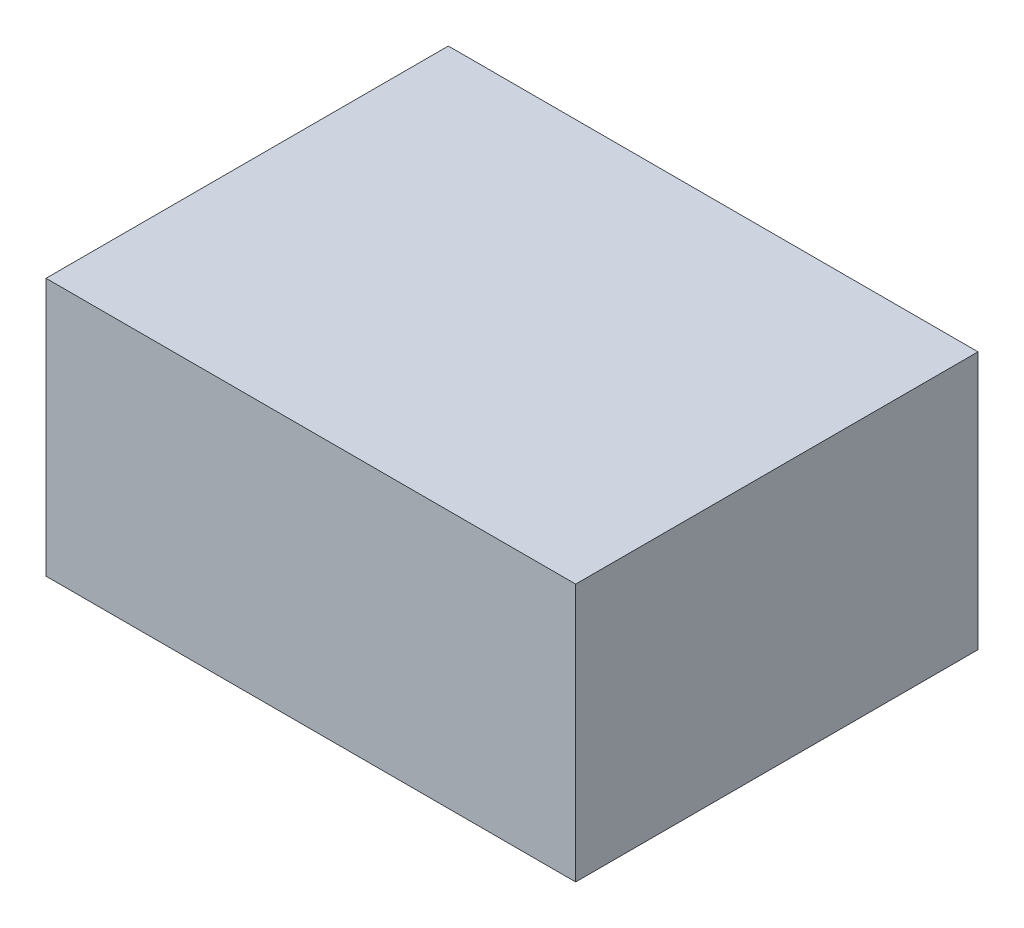
from build123d import *

# Parameters (mm, degrees)
ESQUISSE1_W        = 42.13
ESQUISSE1_H        = 32
BOSS_EXTRU_1_DEPTH = 20.52


with BuildPart() as part:
    # Esquisse1 → Boss.-Extru.1 (new body)
    with BuildSketch(Plane(origin=(0, 0, 0), x_dir=(1, 0, 0), z_dir=(0, 1, 0))):
        with Locations((21.065, 16)):
            Rectangle(ESQUISSE1_W, ESQUISSE1_H)
    extrude(amount=BOSS_EXTRU_1_DEPTH)


solid = part.part
